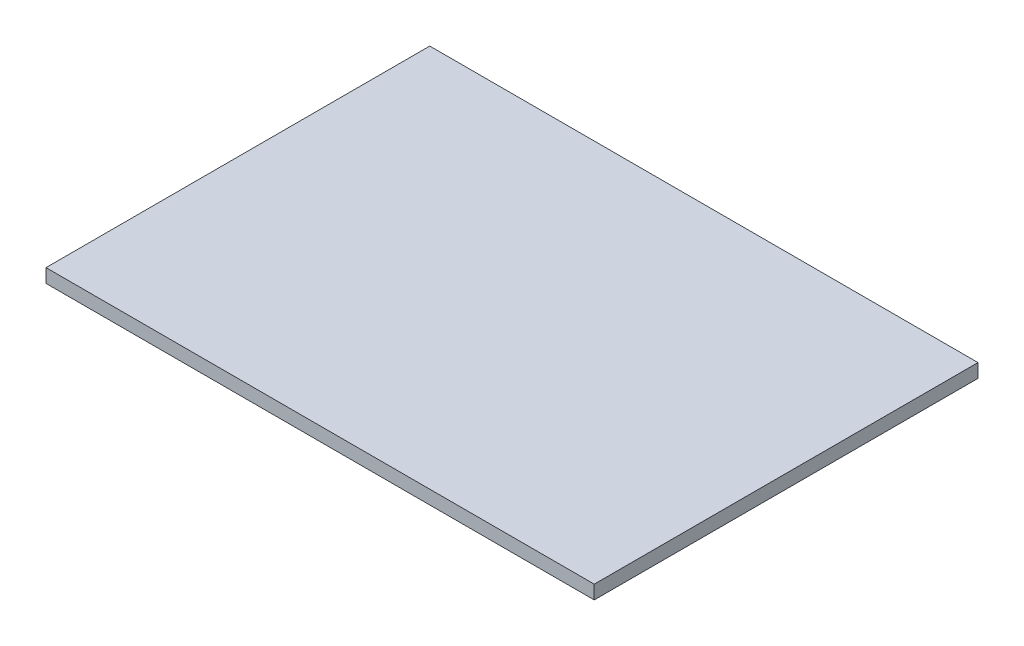
from build123d import *

# Parameters (mm, degrees)
SKETCH1_W           = 200
SKETCH1_H           = 140
BOSS_EXTRUDE1_DEPTH = 5


with BuildPart() as part:
    # Sketch1 → Boss-Extrude1 (new body)
    with BuildSketch(Plane(origin=(0, 0, 0), x_dir=(1, 0, 0), z_dir=(0, 1, 0))):
        with Locations((100, -70)):
            Rectangle(SKETCH1_W, SKETCH1_H)
    extrude(amount=BOSS_EXTRUDE1_DEPTH)


solid = part.part
